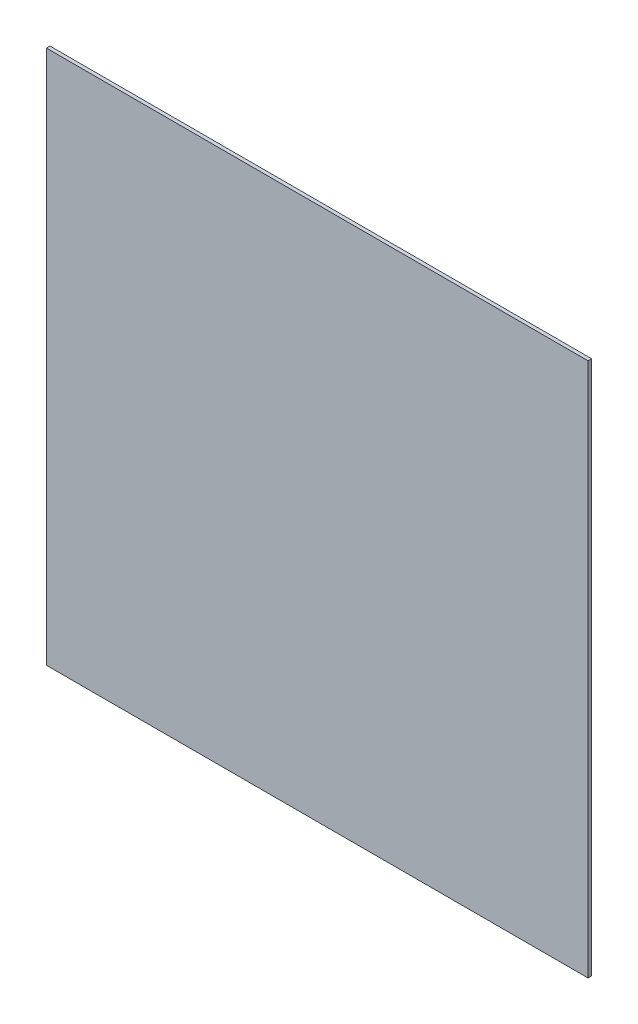
from build123d import *

# Parameters (mm, degrees)
SKETCH_1_W      = 1520
SKETCH_1_H      = 1500
EXTRUDE_1_DEPTH = 10


with BuildPart() as part:
    # Эскиз1 → Бобышка-Вытянуть1 (new body)
    with BuildSketch(Plane.XY):
        with Locations((760, 750)):
            Rectangle(SKETCH_1_W, SKETCH_1_H)
    extrude(amount=EXTRUDE_1_DEPTH)


solid = part.part
